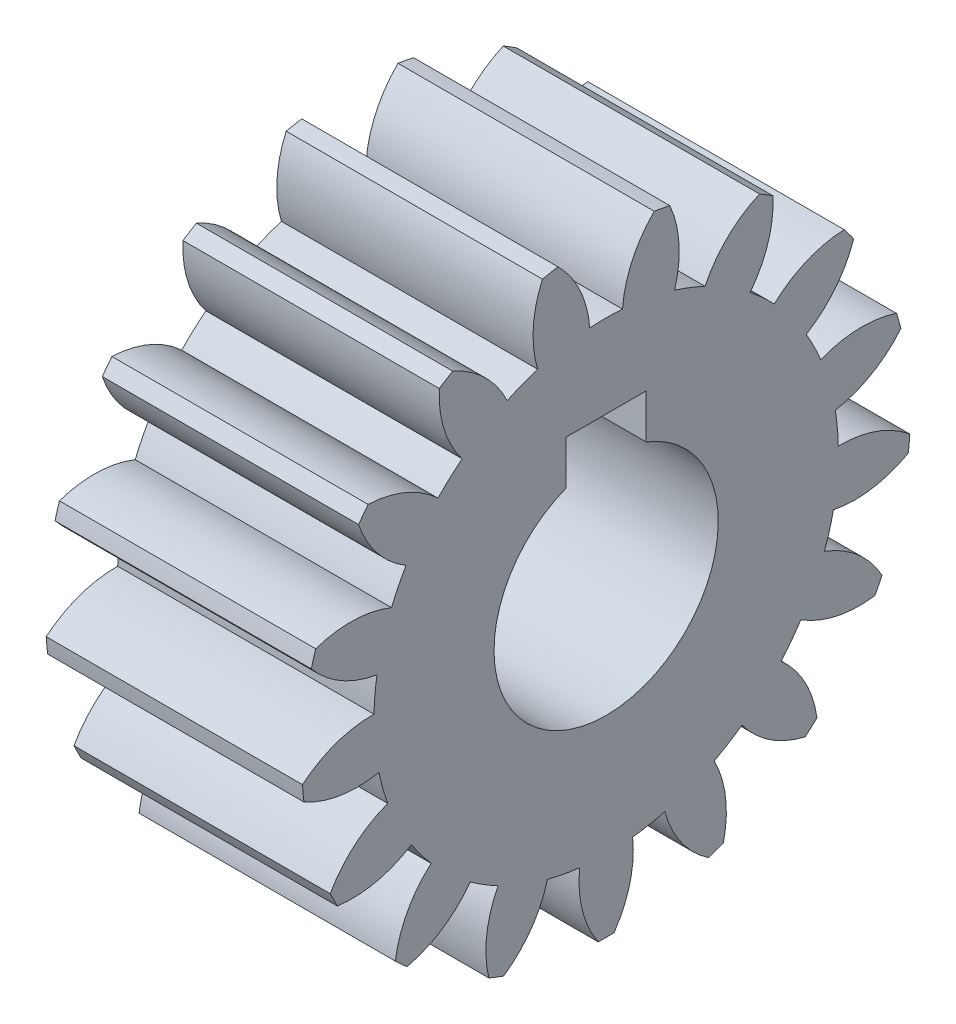
from build123d import *

# Parameters (mm, degrees)
BASPROSKE_W     = 16
BASPROSKE_H     = 19
TOOTHCUT_DEPTH  = 32.272991542
TEETHCUTS_COUNT = 17
TEETHCUTS_ANGLE = 338.823529412
BORSKE_R        = 7
BORE_DEPTH      = 50.0000508
KEYSKE_W        = 5
KEYSKE_H        = 9.3
KEYWAY_DEPTH    = 50.0000508


with BuildPart() as part:
    # BasProSke → Base-Revolve (revolve)
    with BuildSketch(Plane(origin=(0, 0, 0), x_dir=(1, 0, 0), z_dir=(0, 1, 0)), mode=Mode.PRIVATE) as base_revolve_sk:
        with Locations((8, 9.5)):
            Rectangle(BASPROSKE_W, BASPROSKE_H)
    revolve(base_revolve_sk.sketch.rotate(Axis((-10, 0, 0), (1, 0, 0)), 180), axis=Axis((-10, 0, 0), (1, 0, 0)))

    # TooCutSke → ToothCut (cut, through all)
    with BuildSketch(Plane(origin=(0, 0, 0), x_dir=(0, 0, -1), z_dir=(1, 0, 0))):
        with BuildLine():
            ThreePointArc((1.020352389, 14.463052306), (0, 14.499), (-1.020352389, 14.463052306))
            ThreePointArc((-1.020352389, 14.463052306), (-1.632621885, 16.804485203), (-3.026143023, 18.783192049))
            ThreePointArc((-3.026143023, 18.783192049), (0, 19.0254), (3.026143023, 18.783192049))
            ThreePointArc((3.026143023, 18.783192049), (1.632621885, 16.804485203), (1.020352389, 14.463052306))
        make_face()
    toothcut = extrude(amount=TOOTHCUT_DEPTH, mode=Mode.SUBTRACT)

    # TeethCuts: ToothCut ×17 about axis
    teethcuts_axis = Axis((-10, 0, 0), (1, 0, 0))
    for i in range(1, TEETHCUTS_COUNT):
        add(toothcut.rotate(teethcuts_axis, i * TEETHCUTS_ANGLE / (TEETHCUTS_COUNT - 1)), mode=Mode.SUBTRACT)

    # BorSke → Bore (cut, symmetric)
    with BuildSketch(Plane(origin=(0, 0, 0), x_dir=(0, 0, -1), z_dir=(1, 0, 0))):
        with Locations(Location((0, 0, 0), (0, 0, 180))):
            Circle(BORSKE_R)
    extrude(amount=BORE_DEPTH, both=True, mode=Mode.SUBTRACT)

    # KeySke → Keyway (cut, symmetric)
    with BuildSketch(Plane(origin=(0, 0, 0), x_dir=(0, 0, -1), z_dir=(1, 0, 0))):
        with Locations((0, 4.65)):
            Rectangle(KEYSKE_W, KEYSKE_H)
    extrude(amount=KEYWAY_DEPTH, both=True, mode=Mode.SUBTRACT)


solid = part.part
